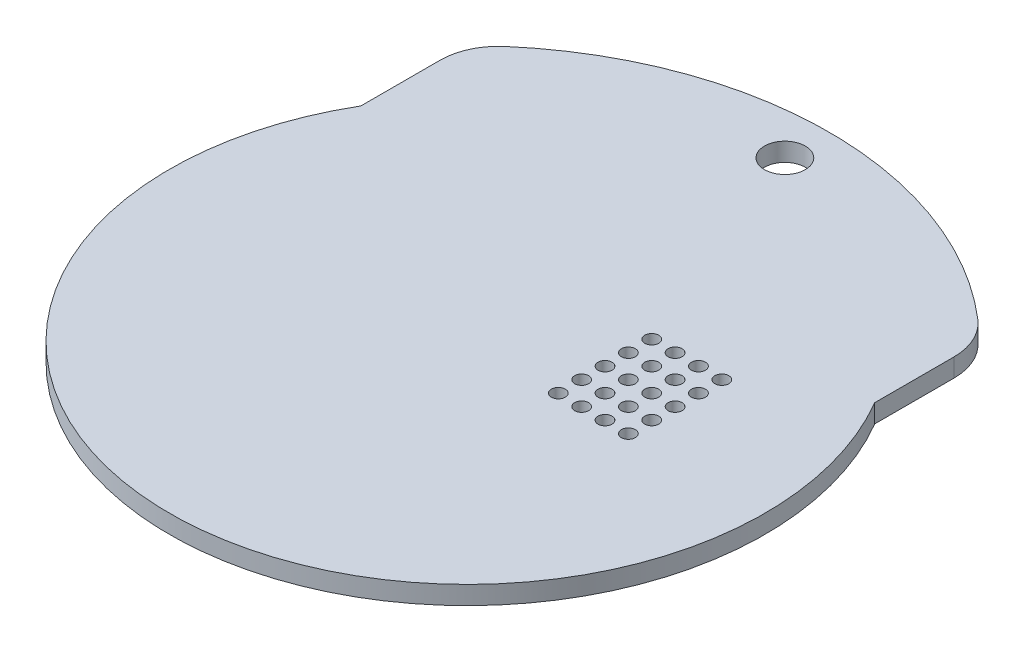
from build123d import *

# Parameters (mm, degrees)
SKETCH1_R           = 32.385
BOSS_EXTRUDE1_DEPTH = 2
FILLET1_R           = 6.35
SKETCH2_R           = 2.2225
CUT_EXTRUDE1_DEPTH  = 52.017498224
SKETCH5_R           = 0.762
CUT_EXTRUDE2_DEPTH  = 52.017498224


with BuildPart() as part:
    # Sketch1 → Boss-Extrude1 (new body)
    with BuildSketch(Plane(origin=(0, 0, 0), x_dir=(1, 0, 0), z_dir=(0, 1, 0))):
        Circle(SKETCH1_R)
        with BuildLine():
            Line((-27.94, 27.737218678), (-27.94, 16.375122137))
            ThreePointArc((-27.94, 16.375122137), (0, 32.385), (27.94, 16.375122137))
            Line((27.94, 16.375122137), (27.94, 27.737218678))
            ThreePointArc((27.94, 27.737218678), (0, 39.37), (-27.94, 27.737218678))
        make_face()
    extrude(amount=BOSS_EXTRUDE1_DEPTH)

    # Fillet1
    fillet1_edges = [part.edges().sort_by_distance(p)[0] for p in [
        (-27.94, 1, -27.737218678),
        (27.94, 1, -27.737218678),
    ]]
    fillet(fillet1_edges, radius=FILLET1_R)

    # Sketch2 → Cut-Extrude1 (cut, through all)
    with BuildSketch(Plane(origin=(0, 2, 0), x_dir=(1, 0, 0), z_dir=(0, 1, 0))):
        with Locations(Location((0, 34.544, 0), (0, 0, 270))):
            Circle(SKETCH2_R)
    extrude(amount=-CUT_EXTRUDE1_DEPTH, mode=Mode.SUBTRACT)

    # Sketch5 → Cut-Extrude2 (cut, through all)
    with BuildSketch(Plane(origin=(0, 2, 0), x_dir=(1, 0, 0), z_dir=(0, 1, 0))):
        with Locations(Location((9.8425, 10.2235, 0), (0, 0, 270))):
            Circle(SKETCH5_R)
        with Locations(Location((12.3825, 10.2235, 0), (0, 0, 270))):
            Circle(SKETCH5_R)
        with Locations(Location((14.9225, 10.2235, 0), (0, 0, 270))):
            Circle(SKETCH5_R)
        with Locations(Location((17.4625, 10.2235, 0), (0, 0, 270))):
            Circle(SKETCH5_R)
        with Locations(Location((9.8425, 7.6835, 0), (0, 0, 270))):
            Circle(SKETCH5_R)
        with Locations(Location((12.3825, 7.6835, 0), (0, 0, 270))):
            Circle(SKETCH5_R)
        with Locations(Location((14.9225, 7.6835, 0), (0, 0, 270))):
            Circle(SKETCH5_R)
        with Locations(Location((17.4625, 7.6835, 0), (0, 0, 270))):
            Circle(SKETCH5_R)
        with Locations(Location((9.8425, 5.1435, 0), (0, 0, 270))):
            Circle(SKETCH5_R)
        with Locations(Location((12.3825, 5.1435, 0), (0, 0, 270))):
            Circle(SKETCH5_R)
        with Locations(Location((14.9225, 5.1435, 0), (0, 0, 270))):
            Circle(SKETCH5_R)
        with Locations(Location((17.4625, 5.1435, 0), (0, 0, 270))):
            Circle(SKETCH5_R)
        with Locations(Location((9.8425, 2.6035, 0), (0, 0, 270))):
            Circle(SKETCH5_R)
        with Locations(Location((12.3825, 2.6035, 0), (0, 0, 270))):
            Circle(SKETCH5_R)
        with Locations(Location((14.9225, 2.6035, 0), (0, 0, 270))):
            Circle(SKETCH5_R)
        with Locations(Location((17.4625, 2.6035, 0), (0, 0, 270))):
            Circle(SKETCH5_R)
        with Locations(Location((9.8425, 0.0635, 0), (0, 0, 270))):
            Circle(SKETCH5_R)
        with Locations(Location((12.3825, 0.0635, 0), (0, 0, 270))):
            Circle(SKETCH5_R)
        with Locations(Location((14.9225, 0.0635, 0), (0, 0, 270))):
            Circle(SKETCH5_R)
        with Locations(Location((17.4625, 0.0635, 0), (0, 0, 270))):
            Circle(SKETCH5_R)
    extrude(amount=-CUT_EXTRUDE2_DEPTH, mode=Mode.SUBTRACT)


solid = part.part
